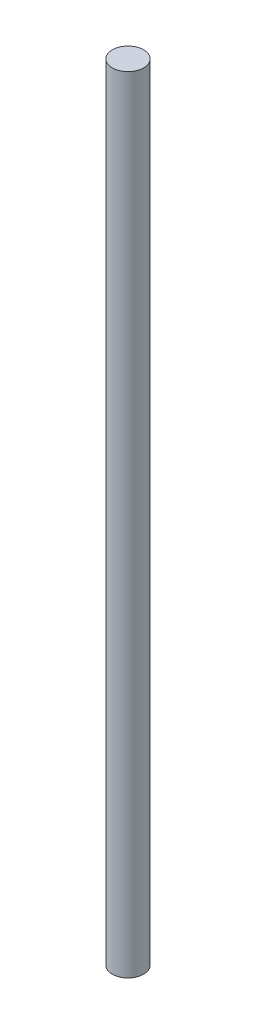
from build123d import *

# Parameters (mm, degrees)
SKETCH2_R           = 3
BOSS_EXTRUDE1_DEPTH = 150


with BuildPart() as part:
    # Sketch2 → Boss-Extrude1 (new body)
    with BuildSketch(Plane(origin=(0, 0, 0), x_dir=(1, 0, 0), z_dir=(0, 1, 0))):
        with Locations(Location((0, 0, 0), (0, 0, 270))):
            Circle(SKETCH2_R)
    extrude(amount=BOSS_EXTRUDE1_DEPTH)


solid = part.part
